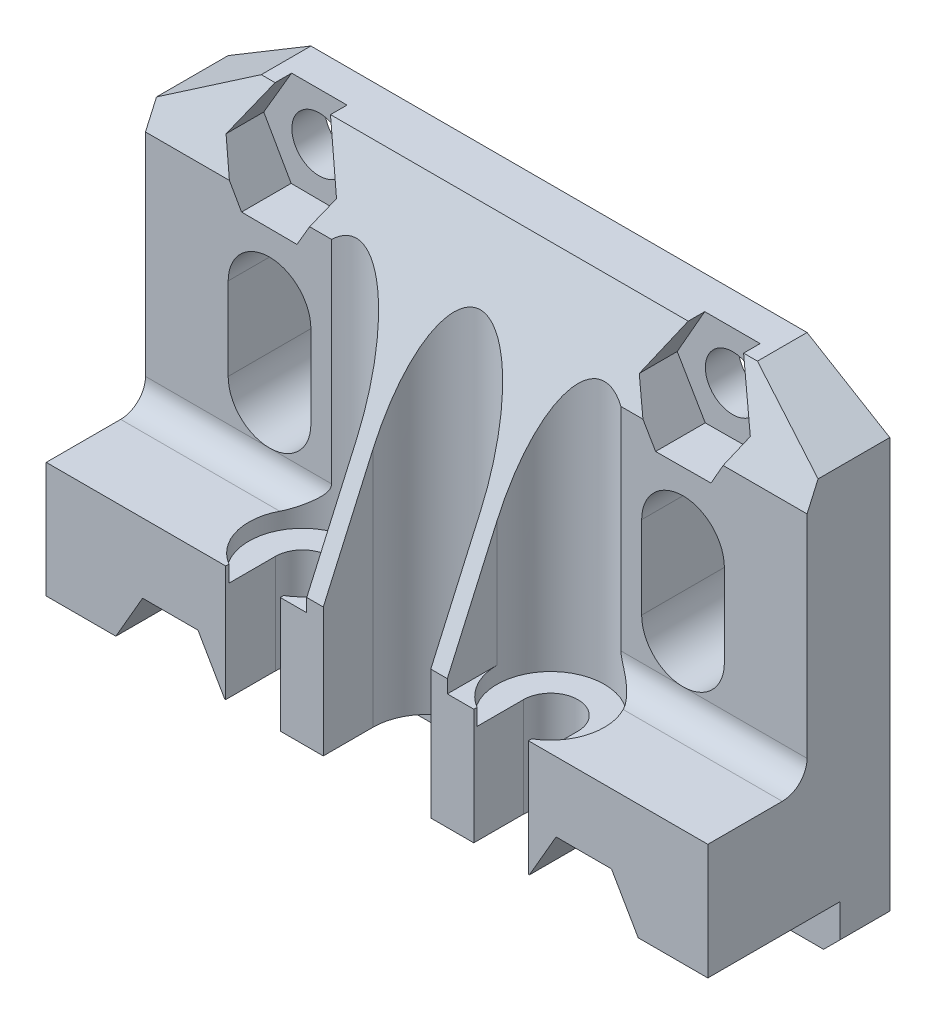
from build123d import *

# Parameters (mm, degrees)
SKETCH1_W           = 40
SKETCH1_H           = 28.8
BOSS_EXTRUDE1_DEPTH = 11
CHAMFER2_SIZE       = 8
CHAMFER2_SIZE2      = 18
SKETCH10_W          = 13.5
SKETCH10_H          = 18.8
CUT_EXTRUDE7_DEPTH  = 6
FILLET1_R           = 1.5
SKETCH11_W          = 40
SKETCH11_H          = 3
CUT_EXTRUDE8_DEPTH  = 8
CUT_EXTRUDE9_REACH  = 38.748
CUT_EXTRUDE10_DEPTH = 30.57093174
CUT_EXTRUDE2_DEPTH  = 30
SKETCH2_R           = 1.65
CUT_EXTRUDE1_DEPTH  = 37.74833335
CUT_EXTRUDE4_DEPTH  = 9
SKETCH15_R          = 3.25
CUT_EXTRUDE12_DEPTH = 1
CUT_EXTRUDE13_DEPTH = 36.573023543
CHAMFER4_SIZE       = 3
CHAMFER4_SIZE2      = 5
CHAMFER5_SIZE       = 5
CHAMFER5_SIZE2      = 3
CUT_EXTRUDE11_DEPTH = 9.4
CHAMFER8_SIZE       = 1


with BuildPart() as part:
    # Sketch1 → Boss-Extrude1 (new body)
    with BuildSketch(Plane.XY):
        with Locations((0, 14.4)):
            Rectangle(SKETCH1_W, SKETCH1_H)
    extrude(amount=BOSS_EXTRUDE1_DEPTH)

    # Chamfer2
    chamfer2_edges = [part.edges().sort_by_distance(p)[0] for p in [
        (0, 28.8, 11),
    ]]
    chamfer2_side = [part.faces().sort_by_distance(p)[0] for p in [
        (0, 28.8, 5.5),
    ]]
    chamfer(chamfer2_edges, length=CHAMFER2_SIZE, length2=CHAMFER2_SIZE2, reference=chamfer2_side[0])

    # Sketch10 → Cut-Extrude7 (cut)
    with BuildSketch(Plane.XY.offset(11)):
        with Locations((-13.25, 19.4)):
            Rectangle(SKETCH10_W, SKETCH10_H)
        with Locations((13.25, 19.4)):
            Rectangle(SKETCH10_W, SKETCH10_H)
    extrude(amount=-CUT_EXTRUDE7_DEPTH, mode=Mode.SUBTRACT)

    # Fillet1
    fillet1_edges = [part.edges().sort_by_distance(p)[0] for p in [
        (-13.25, 10, 5),
        (13.25, 10, 5),
    ]]
    fillet(fillet1_edges, radius=FILLET1_R)

    # Sketch11 → Cut-Extrude8 (cut)
    with BuildSketch(Plane.XY.offset(11)):
        with Locations((0, 1.5)):
            Rectangle(SKETCH11_W, SKETCH11_H)
    extrude(amount=-CUT_EXTRUDE8_DEPTH, mode=Mode.SUBTRACT)

    # Cut-Extrude9: up to this face of the body (flat: up to its plane)
    cut_extrude9_end = Plane(part.part.faces().sort_by_distance((-13.25, 10, 8.75))[0])
    # Sketch12 → Cut-Extrude9 (cut, up to the picked face)
    with BuildSketch(Plane(origin=(0, 28.8, 0), x_dir=(1, 0, 0), z_dir=(0, 1, 0)), mode=Mode.PRIVATE) as cut_extrude9_sk1:
        with BuildLine():
            Line((-4.25, -8), (-4.25, -11))
            Line((-4.25, -11), (-10.75, -11))
            Line((-10.75, -11), (-10.75, -8))
            ThreePointArc((-10.75, -8), (-7.5, -4.75), (-4.25, -8))
        make_face()
    cut_extrude9_tool1 = split(extrude(cut_extrude9_sk1.sketch, amount=-CUT_EXTRUDE9_REACH, mode=Mode.PRIVATE), bisect_by=cut_extrude9_end, keep=Keep.BOTH, mode=Mode.PRIVATE)
    cut_extrude9 = cut_extrude9_tool1.solids().sort_by(Axis((-7.5, 28.8, 8.176346), (0, -1, 0)))[0]
    add(cut_extrude9, mode=Mode.SUBTRACT)

    # Sketch13 → Cut-Extrude10 (cut, through all)
    with BuildSketch(Plane(origin=(0, 10, 0), x_dir=(1, 0, 0), z_dir=(0, 1, 0))):
        with BuildLine():
            Line((-9.15, -8), (-9.15, -11))
            Line((-9.15, -11), (-5.85, -11))
            Line((-5.85, -11), (-5.85, -8))
            ThreePointArc((-5.85, -8), (-7.5, -6.35), (-9.15, -8))
        make_face()
    cut_extrude10 = extrude(amount=-CUT_EXTRUDE10_DEPTH, mode=Mode.SUBTRACT)

    # Sketch3 → Cut-Extrude2 (cut)
    with BuildSketch(Plane.XZ):
        with BuildLine():
            Line((-3.25, 8), (-3.25, 11))
            Line((-3.25, 11), (3.25, 11))
            Line((3.25, 11), (3.25, 8))
            ThreePointArc((3.25, 8), (0, 4.75), (-3.25, 8))
        make_face()
    extrude(amount=-CUT_EXTRUDE2_DEPTH, mode=Mode.SUBTRACT)

    # Sketch2 → Cut-Extrude1 (cut, through all)
    with BuildSketch(Plane.XY.offset(11)):
        with Locations((-12.5, 2.9)):
            Circle(SKETCH2_R)
        with Locations((12.5, 2.9)):
            Circle(SKETCH2_R)
        with Locations((12.5, 25.9)):
            Circle(SKETCH2_R)
        with Locations((-12.5, 25.9)):
            Circle(SKETCH2_R)
    extrude(amount=-CUT_EXTRUDE1_DEPTH, mode=Mode.SUBTRACT)

    # Sketch5 → Cut-Extrude4 (cut)
    with BuildSketch(Plane.XY.offset(11)):
        Polygon((-13.825512835, 29.376278709), (-11.142302486, 29.376278709), (-9.151427839, 25.880054666), (-10.842987085, 22.990078775), (-14.191559246, 23.010024109), (-15.848572161, 25.919945334), align=None)
        Polygon((11.142302486, 29.376278709), (13.825512835, 29.376278709), (15.848572161, 25.919945334), (14.191559246, 23.010024109), (10.842987085, 22.990078775), (9.151427839, 25.880054666), align=None)
    extrude(amount=-CUT_EXTRUDE4_DEPTH, mode=Mode.SUBTRACT)

    # Sketch15 → Cut-Extrude12 (cut)
    with BuildSketch(Plane(origin=(0, 10, 0), x_dir=(1, 0, 0), z_dir=(0, 1, 0))):
        with Locations((-7.5, -8)):
            Circle(SKETCH15_R)
    cut_extrude12 = extrude(amount=-CUT_EXTRUDE12_DEPTH, mode=Mode.SUBTRACT)

    # Sketch16 → Cut-Extrude13 (cut, through all)
    with BuildSketch(Plane.XY.offset(5)):
        with BuildLine():
            Line((-15, 14), (-15, 19))
            ThreePointArc((-15, 19), (-12.5, 21.5), (-10, 19))
            Line((-10, 19), (-10, 14))
            ThreePointArc((-10, 14), (-12.5, 11.5), (-15, 14))
        make_face()
    cut_extrude13 = extrude(amount=-CUT_EXTRUDE13_DEPTH, mode=Mode.SUBTRACT)

    # Mirror1: Cut-Extrude9, Cut-Extrude10, Cut-Extrude12, Cut-Extrude13 across plane
    add(cut_extrude9.mirror(Plane(origin=(0, 0, 0), x_dir=(0, 0, 1), z_dir=(1, 0, 0))), mode=Mode.SUBTRACT)
    add(cut_extrude10.mirror(Plane(origin=(0, 0, 0), x_dir=(0, 0, 1), z_dir=(1, 0, 0))), mode=Mode.SUBTRACT)
    add(cut_extrude12.mirror(Plane(origin=(0, 0, 0), x_dir=(0, 0, 1), z_dir=(1, 0, 0))), mode=Mode.SUBTRACT)
    add(cut_extrude13.mirror(Plane(origin=(0, 0, 0), x_dir=(0, 0, 1), z_dir=(1, 0, 0))), mode=Mode.SUBTRACT)

    # Chamfer4
    chamfer4_edges = [part.edges().sort_by_distance(p)[0] for p in [
        (20, 28.8, 1.5),
    ]]
    chamfer4_side = [part.faces().sort_by_distance(p)[0] for p in [
        (20, 12.613389716, 3.722385656),
    ]]
    chamfer(chamfer4_edges, length=CHAMFER4_SIZE, length2=CHAMFER4_SIZE2, reference=chamfer4_side[0])

    # Chamfer5
    chamfer5_edges = [part.edges().sort_by_distance(p)[0] for p in [
        (-20, 28.8, 1.5),
    ]]
    chamfer5_side = [part.faces().sort_by_distance(p)[0] for p in [
        (-2.670324549, 28.8, 1.43187018),
    ]]
    chamfer(chamfer5_edges, length=CHAMFER5_SIZE, length2=CHAMFER5_SIZE2, reference=chamfer5_side[0])

    # Sketch14 → Cut-Extrude11 (cut)
    with BuildSketch(Plane.XY.offset(11)):
        Polygon((-9.151368439, 2.9), (-10.825684219, 5.8), (-14.174315781, 5.8), (-15.848631561, 2.9), (-14.174315781, 0), (-10.825684219, 0), align=None)
        Polygon((15.848631561, 2.9), (14.174315781, 5.8), (10.825684219, 5.8), (9.151368439, 2.9), (10.825684219, 0), (14.174315781, 0), align=None)
    extrude(amount=-CUT_EXTRUDE11_DEPTH, mode=Mode.SUBTRACT)

    # Chamfer8
    chamfer8_edges = [part.edges().sort_by_distance(p)[0] for p in [
        (20, 0, 1.5),
        (-20, 0, 1.5),
    ]]
    chamfer(chamfer8_edges, length=CHAMFER8_SIZE)


solid = part.part
